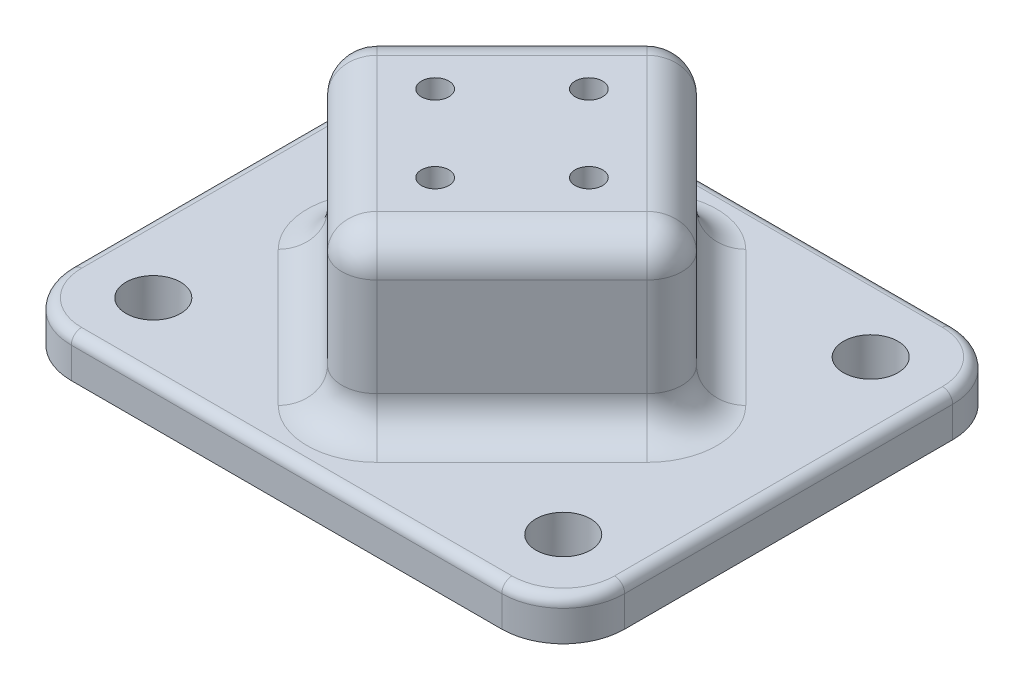
from build123d import *

# Parameters (mm, degrees)
SKETCH4_W               = 63.5
SKETCH4_H               = 50.8
BOSS_EXTRUDE2_DEPTH     = 5.08
F_1_4_CLEARANCE_HOLE2_D = 6.7564
BOSS_EXTRUDE3_DEPTH     = 20.828
M3_CLEARANCE_HOLE1_D    = 3.4
CUT_EXTRUDE1_DEPTH      = 20.828
FILLET2_R               = 4.318
SKETCH13_W              = 68.58
SKETCH13_H              = 55.88
SKETCH13_W_2            = 63.5
SKETCH13_H_2            = 50.8
BOSS_EXTRUDE4_DEPTH     = 5.08
FILLET3_R               = 7.62
FILLET4_R               = 1.27


with BuildPart() as part:
    # Sketch4 → Boss-Extrude2 (new body)
    with BuildSketch(Plane(origin=(0, 0, 0), x_dir=(1, 0, 0), z_dir=(0, 1, 0))):
        Rectangle(SKETCH4_W, SKETCH4_H)
    extrude(amount=BOSS_EXTRUDE2_DEPTH)

    # 1/4 Clearance Hole2 (through all)
    with Locations(Plane(origin=(-25.4, 5.08, -19.05), x_dir=(0, 0, 1), z_dir=(0, 1, 0))):
        with Locations((0, 0), (0, 50.8), (38.1, 50.8), (38.1, 0)):
            Hole(F_1_4_CLEARANCE_HOLE2_D / 2)

    # Sketch7 → Boss-Extrude3 (add)
    with BuildSketch(Plane(origin=(0, 5.08, 0), x_dir=(1, 0, 0), z_dir=(0, 1, 0))):
        Polygon((0, 22.86), (22.86, 0), (0, -22.86), (-22.86, 0), align=None)
    extrude(amount=BOSS_EXTRUDE3_DEPTH)

    # M3 Clearance Hole1 (through all)
    with Locations(Plane(origin=(0, 25.908, -9.525), x_dir=(0, 0, 1), z_dir=(0, 1, 0))):
        with Locations((0, 0), (9.525, 9.525), (19.05, 0), (9.525, -9.525)):
            Hole(M3_CLEARANCE_HOLE1_D / 2)

    # Sketch12 → Cut-Extrude1 (cut)
    with BuildSketch(Plane(origin=(0, 0, 0), x_dir=(-1, 0, 0), z_dir=(0, -1, 0))):
        Polygon((0, -19.05), (-19.05, 0), (0, 19.05), (19.05, 0), align=None)
    extrude(amount=-CUT_EXTRUDE1_DEPTH, mode=Mode.SUBTRACT)

    # Fillet2
    fillet2_edges = [part.edges().sort_by_distance(p)[0] for p in [
        (-11.43, 5.08, -11.43),
        (0, 15.494, -22.86),
        (-11.43, 5.08, 11.43),
        (-22.86, 15.494, 0),
        (11.43, 5.08, 11.43),
        (0, 15.494, 22.86),
        (11.43, 5.08, -11.43),
        (22.86, 15.494, 0),
        (-11.43, 25.908, -11.43),
        (-11.43, 25.908, 11.43),
        (11.43, 25.908, 11.43),
        (11.43, 25.908, -11.43),
    ]]
    fillet(fillet2_edges, radius=FILLET2_R)

    # Sketch13 → Boss-Extrude4 (add)
    with BuildSketch(Plane.XZ):
        Rectangle(SKETCH13_W, SKETCH13_H)
        Rectangle(SKETCH13_W_2, SKETCH13_H_2, mode=Mode.SUBTRACT)
    extrude(amount=-BOSS_EXTRUDE4_DEPTH)

    # Fillet3
    fillet3_edges = [part.edges().sort_by_distance(p)[0] for p in [
        (-34.29, 2.54, -27.94),
        (-34.29, 2.54, 27.94),
        (34.29, 2.54, 27.94),
        (34.29, 2.54, -27.94),
    ]]
    fillet(fillet3_edges, radius=FILLET3_R)

    # Fillet4
    fillet4_edges = [part.edges().sort_by_distance(p)[0] for p in [
        (0, 5.08, 27.94),
        (-34.29, 5.08, 0),
        (34.29, 5.08, 0),
        (0, 5.08, -27.94),
        (32.058153673, 5.08, -25.708153673),
        (32.058153673, 5.08, 25.708153673),
        (-32.058153673, 5.08, -25.708153673),
        (-32.058153673, 5.08, 25.708153673),
    ]]
    fillet(fillet4_edges, radius=FILLET4_R)


solid = part.part
